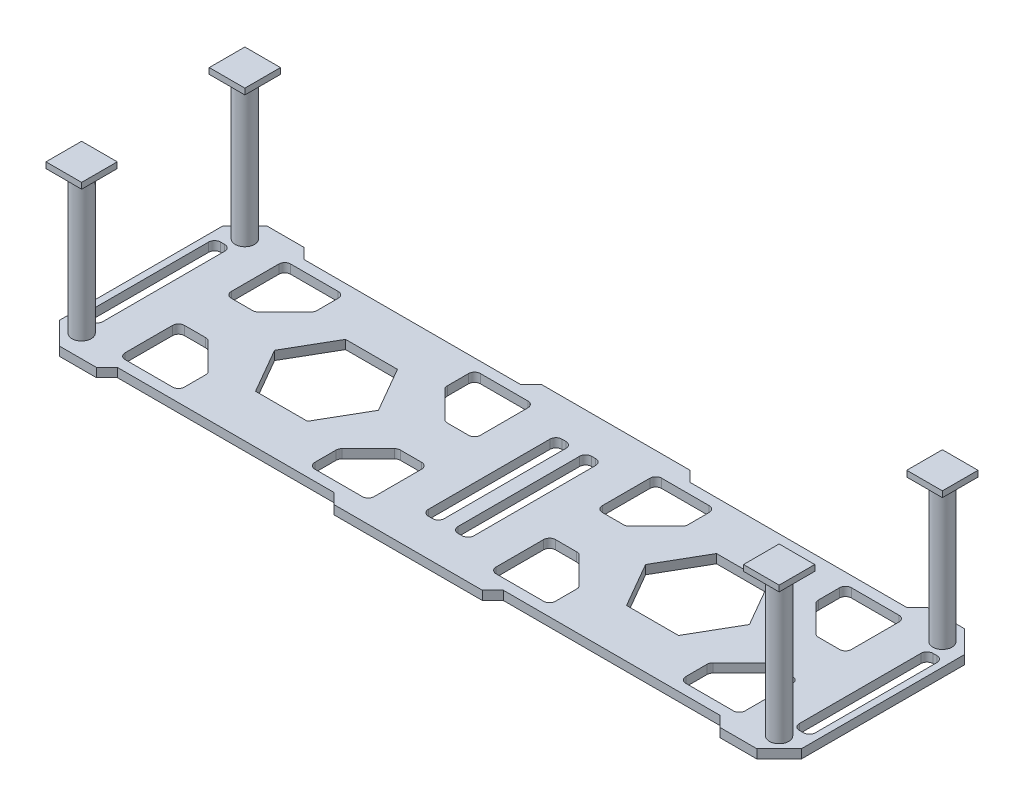
from build123d import *

# Parameters (mm, degrees)
BOSS_EXTRUDE1_DEPTH = 3
CHAMFER1_SIZE       = 7.5
SKETCH2_R           = 3.25
BOSS_EXTRUDE2_DEPTH = 48
SKETCH3_W           = 12
SKETCH3_H           = 12
BOSS_EXTRUDE3_DEPTH = 2


with BuildPart() as part:
    # Sketch1 → Boss-Extrude1 (new body)
    with BuildSketch(Plane(origin=(0, 0, 0), x_dir=(1, 0, 0), z_dir=(0, 1, 0))):
        Polygon((0, 0), (20, 0), (23.535533906, 3.535533906), (96.467358346, 3.535533906), (100.002892252, 0), (149.997107748, 0), (153.532641654, 3.535533906), (226.464466094, 3.535533906), (230, 0), (250, 0), (250, 70), (230, 70), (226.464466094, 66.464466094), (153.532641654, 66.464466094), (149.997107748, 70), (100.002892252, 70), (96.467358346, 66.464466094), (23.535533906, 66.464466094), (20, 70), (0, 70), align=None)
        Polygon((80, 35), (71.25, 50.155444566), (53.75, 50.155444566), (45, 35), (53.75, 19.844555434), (71.25, 19.844555434), align=None, mode=Mode.SUBTRACT)
        with BuildLine():
            Line((4.300976863, 12.5), (5.699023137, 12.5))
            ThreePointArc((5.699023137, 12.5), (7.1132367, 13.085786438), (7.699023137, 14.5))
            Line((7.699023137, 14.5), (7.699023137, 55.5))
            ThreePointArc((7.699023137, 55.5), (7.1132367, 56.914213562), (5.699023137, 57.5))
            Line((5.699023137, 57.5), (4.300976863, 57.5))
            ThreePointArc((4.300976863, 57.5), (2.8867633, 56.914213562), (2.300976863, 55.5))
            Line((2.300976863, 55.5), (2.300976863, 14.5))
            ThreePointArc((2.300976863, 14.5), (2.8867633, 13.085786438), (4.300976863, 12.5))
        make_face(mode=Mode.SUBTRACT)
        with BuildLine():
            Line((117.300976863, 14.5), (117.300976863, 55.5))
            ThreePointArc((117.300976863, 55.5), (117.8867633, 56.914213562), (119.300976863, 57.5))
            Line((119.300976863, 57.5), (120.699023137, 57.5))
            ThreePointArc((120.699023137, 57.5), (122.1132367, 56.914213562), (122.699023137, 55.5))
            Line((122.699023137, 55.5), (122.699023137, 14.5))
            ThreePointArc((122.699023137, 14.5), (122.1132367, 13.085786438), (120.699023137, 12.5))
            Line((120.699023137, 12.5), (119.300976863, 12.5))
            ThreePointArc((119.300976863, 12.5), (117.8867633, 13.085786438), (117.300976863, 14.5))
        make_face(mode=Mode.SUBTRACT)
        with BuildLine():
            Line((31.123496996, 43.484668525), (39.951924121, 52.31309565))
            ThreePointArc((39.951924121, 52.31309565), (40.385469623, 52.961942347), (40.537710558, 53.727309212))
            Line((40.537710558, 53.727309212), (40.537710558, 60.898882087))
            ThreePointArc((40.537710558, 60.898882087), (39.951924121, 62.31309565), (38.537710558, 62.898882087))
            Line((38.537710558, 62.898882087), (22.537710558, 62.898882087))
            ThreePointArc((22.537710558, 62.898882087), (21.123496996, 62.31309565), (20.537710558, 60.898882087))
            Line((20.537710558, 60.898882087), (20.537710558, 44.898882087))
            ThreePointArc((20.537710558, 44.898882087), (21.123496996, 43.484668525), (22.537710558, 42.898882087))
            Line((22.537710558, 42.898882087), (29.709283433, 42.898882087))
            ThreePointArc((29.709283433, 42.898882087), (30.474650298, 43.051123022), (31.123496996, 43.484668525))
        make_face(mode=Mode.SUBTRACT)
        with BuildLine():
            Line((40.537710558, 9.101117913), (40.537710558, 16.272690788))
            ThreePointArc((40.537710558, 16.272690788), (40.385469623, 17.038057653), (39.951924121, 17.68690435))
            Line((39.951924121, 17.68690435), (31.123496996, 26.515331475))
            ThreePointArc((31.123496996, 26.515331475), (30.474650298, 26.948876978), (29.709283433, 27.101117913))
            Line((29.709283433, 27.101117913), (22.537710558, 27.101117913))
            ThreePointArc((22.537710558, 27.101117913), (21.123496996, 26.515331475), (20.537710558, 25.101117913))
            Line((20.537710558, 25.101117913), (20.537710558, 9.101117913))
            ThreePointArc((20.537710558, 9.101117913), (21.123496996, 7.68690435), (22.537710558, 7.101117913))
            Line((22.537710558, 7.101117913), (38.537710558, 7.101117913))
            ThreePointArc((38.537710558, 7.101117913), (39.951924121, 7.68690435), (40.537710558, 9.101117913))
        make_face(mode=Mode.SUBTRACT)
        with BuildLine():
            Line((93.876503004, 26.515331475), (85.048075879, 17.68690435))
            ThreePointArc((85.048075879, 17.68690435), (84.614530377, 17.038057653), (84.462289442, 16.272690788))
            Line((84.462289442, 16.272690788), (84.462289442, 9.101117913))
            ThreePointArc((84.462289442, 9.101117913), (85.048075879, 7.68690435), (86.462289442, 7.101117913))
            Line((86.462289442, 7.101117913), (102.462289442, 7.101117913))
            ThreePointArc((102.462289442, 7.101117913), (103.876503004, 7.68690435), (104.462289442, 9.101117913))
            Line((104.462289442, 9.101117913), (104.462289442, 25.101117913))
            ThreePointArc((104.462289442, 25.101117913), (103.876503004, 26.515331475), (102.462289442, 27.101117913))
            Line((102.462289442, 27.101117913), (95.290716567, 27.101117913))
            ThreePointArc((95.290716567, 27.101117913), (94.525349702, 26.948876978), (93.876503004, 26.515331475))
        make_face(mode=Mode.SUBTRACT)
        with BuildLine():
            Line((84.462289442, 60.898882087), (84.462289442, 53.727309212))
            ThreePointArc((84.462289442, 53.727309212), (84.614530377, 52.961942347), (85.048075879, 52.31309565))
            Line((85.048075879, 52.31309565), (93.876503004, 43.484668525))
            ThreePointArc((93.876503004, 43.484668525), (94.525349702, 43.051123022), (95.290716567, 42.898882087))
            Line((95.290716567, 42.898882087), (102.462289442, 42.898882087))
            ThreePointArc((102.462289442, 42.898882087), (103.876503004, 43.484668525), (104.462289442, 44.898882087))
            Line((104.462289442, 44.898882087), (104.462289442, 60.898882087))
            ThreePointArc((104.462289442, 60.898882087), (103.876503004, 62.31309565), (102.462289442, 62.898882087))
            Line((102.462289442, 62.898882087), (86.462289442, 62.898882087))
            ThreePointArc((86.462289442, 62.898882087), (85.048075879, 62.31309565), (84.462289442, 60.898882087))
        make_face(mode=Mode.SUBTRACT)
        with BuildLine():
            Line((156.123496996, 43.484668525), (164.951924121, 52.31309565))
            ThreePointArc((164.951924121, 52.31309565), (165.385469623, 52.961942347), (165.537710558, 53.727309212))
            Line((165.537710558, 53.727309212), (165.537710558, 60.898882087))
            ThreePointArc((165.537710558, 60.898882087), (164.951924121, 62.31309565), (163.537710558, 62.898882087))
            Line((163.537710558, 62.898882087), (147.537710558, 62.898882087))
            ThreePointArc((147.537710558, 62.898882087), (146.123496996, 62.31309565), (145.537710558, 60.898882087))
            Line((145.537710558, 60.898882087), (145.537710558, 44.898882087))
            ThreePointArc((145.537710558, 44.898882087), (146.123496996, 43.484668525), (147.537710558, 42.898882087))
            Line((147.537710558, 42.898882087), (154.709283433, 42.898882087))
            ThreePointArc((154.709283433, 42.898882087), (155.474650298, 43.051123022), (156.123496996, 43.484668525))
        make_face(mode=Mode.SUBTRACT)
        with BuildLine():
            Line((165.537710558, 9.101117913), (165.537710558, 16.272690788))
            ThreePointArc((165.537710558, 16.272690788), (165.385469623, 17.038057653), (164.951924121, 17.68690435))
            Line((164.951924121, 17.68690435), (156.123496996, 26.515331475))
            ThreePointArc((156.123496996, 26.515331475), (155.474650298, 26.948876978), (154.709283433, 27.101117913))
            Line((154.709283433, 27.101117913), (147.537710558, 27.101117913))
            ThreePointArc((147.537710558, 27.101117913), (146.123496996, 26.515331475), (145.537710558, 25.101117913))
            Line((145.537710558, 25.101117913), (145.537710558, 9.101117913))
            ThreePointArc((145.537710558, 9.101117913), (146.123496996, 7.68690435), (147.537710558, 7.101117913))
            Line((147.537710558, 7.101117913), (163.537710558, 7.101117913))
            ThreePointArc((163.537710558, 7.101117913), (164.951924121, 7.68690435), (165.537710558, 9.101117913))
        make_face(mode=Mode.SUBTRACT)
        with BuildLine():
            Line((218.876503004, 26.515331475), (210.048075879, 17.68690435))
            ThreePointArc((210.048075879, 17.68690435), (209.614530377, 17.038057653), (209.462289442, 16.272690788))
            Line((209.462289442, 16.272690788), (209.462289442, 9.101117913))
            ThreePointArc((209.462289442, 9.101117913), (210.048075879, 7.68690435), (211.462289442, 7.101117913))
            Line((211.462289442, 7.101117913), (227.462289442, 7.101117913))
            ThreePointArc((227.462289442, 7.101117913), (228.876503004, 7.68690435), (229.462289442, 9.101117913))
            Line((229.462289442, 9.101117913), (229.462289442, 25.101117913))
            ThreePointArc((229.462289442, 25.101117913), (228.876503004, 26.515331475), (227.462289442, 27.101117913))
            Line((227.462289442, 27.101117913), (220.290716567, 27.101117913))
            ThreePointArc((220.290716567, 27.101117913), (219.525349702, 26.948876978), (218.876503004, 26.515331475))
        make_face(mode=Mode.SUBTRACT)
        with BuildLine():
            Line((209.462289442, 60.898882087), (209.462289442, 53.727309212))
            ThreePointArc((209.462289442, 53.727309212), (209.614530377, 52.961942347), (210.048075879, 52.31309565))
            Line((210.048075879, 52.31309565), (218.876503004, 43.484668525))
            ThreePointArc((218.876503004, 43.484668525), (219.525349702, 43.051123022), (220.290716567, 42.898882087))
            Line((220.290716567, 42.898882087), (227.462289442, 42.898882087))
            ThreePointArc((227.462289442, 42.898882087), (228.876503004, 43.484668525), (229.462289442, 44.898882087))
            Line((229.462289442, 44.898882087), (229.462289442, 60.898882087))
            ThreePointArc((229.462289442, 60.898882087), (228.876503004, 62.31309565), (227.462289442, 62.898882087))
            Line((227.462289442, 62.898882087), (211.462289442, 62.898882087))
            ThreePointArc((211.462289442, 62.898882087), (210.048075879, 62.31309565), (209.462289442, 60.898882087))
        make_face(mode=Mode.SUBTRACT)
        with BuildLine():
            Line((129.300976863, 12.5), (130.699023137, 12.5))
            ThreePointArc((130.699023137, 12.5), (132.1132367, 13.085786438), (132.699023137, 14.5))
            Line((132.699023137, 14.5), (132.699023137, 55.5))
            ThreePointArc((132.699023137, 55.5), (132.1132367, 56.914213562), (130.699023137, 57.5))
            Line((130.699023137, 57.5), (129.300976863, 57.5))
            ThreePointArc((129.300976863, 57.5), (127.8867633, 56.914213562), (127.300976863, 55.5))
            Line((127.300976863, 55.5), (127.300976863, 14.5))
            ThreePointArc((127.300976863, 14.5), (127.8867633, 13.085786438), (129.300976863, 12.5))
        make_face(mode=Mode.SUBTRACT)
        with BuildLine():
            Line((242.300976863, 14.5), (242.300976863, 55.5))
            ThreePointArc((242.300976863, 55.5), (242.8867633, 56.914213562), (244.300976863, 57.5))
            Line((244.300976863, 57.5), (245.699023137, 57.5))
            ThreePointArc((245.699023137, 57.5), (247.1132367, 56.914213562), (247.699023137, 55.5))
            Line((247.699023137, 55.5), (247.699023137, 14.5))
            ThreePointArc((247.699023137, 14.5), (247.1132367, 13.085786438), (245.699023137, 12.5))
            Line((245.699023137, 12.5), (244.300976863, 12.5))
            ThreePointArc((244.300976863, 12.5), (242.8867633, 13.085786438), (242.300976863, 14.5))
        make_face(mode=Mode.SUBTRACT)
        Polygon((178.75, 19.844555434), (170, 35), (178.75, 50.155444566), (196.25, 50.155444566), (205, 35), (196.25, 19.844555434), align=None, mode=Mode.SUBTRACT)
    extrude(amount=BOSS_EXTRUDE1_DEPTH)

    # Chamfer1
    chamfer1_edges = [part.edges().sort_by_distance(p)[0] for p in [
        (250, 1.5, -70),
        (250, 1.5, 0),
        (0, 1.5, 0),
        (0, 1.5, -70),
    ]]
    chamfer(chamfer1_edges, length=CHAMFER1_SIZE)

    # Sketch2 → Boss-Extrude2 (add)
    with BuildSketch(Plane(origin=(0, 51, 0), x_dir=(1, 0, 0), z_dir=(0, 1, 0))):
        with Locations(Location((7.5, 7.5, 0), (0, 0, 270))):
            Circle(SKETCH2_R)
        with Locations(Location((7.5, 62.5, 0), (0, 0, 270))):
            Circle(SKETCH2_R)
        with Locations(Location((242.5, 62.5, 0), (0, 0, 270))):
            Circle(SKETCH2_R)
        with Locations(Location((242.5, 7.5, 0), (0, 0, 270))):
            Circle(SKETCH2_R)
    extrude(amount=-BOSS_EXTRUDE2_DEPTH)

    # Sketch3 → Boss-Extrude3 (add)
    with BuildSketch(Plane(origin=(0, 51, 0), x_dir=(1, 0, 0), z_dir=(0, 1, 0))):
        with Locations((7.5, 62.5)):
            Rectangle(SKETCH3_W, SKETCH3_H)
        with Locations((7.5, 7.5)):
            Rectangle(SKETCH3_W, SKETCH3_H)
        with Locations((242.5, 7.5)):
            Rectangle(SKETCH3_W, SKETCH3_H)
        with Locations((242.5, 62.5)):
            Rectangle(SKETCH3_W, SKETCH3_H)
    extrude(amount=BOSS_EXTRUDE3_DEPTH)


solid = part.part
